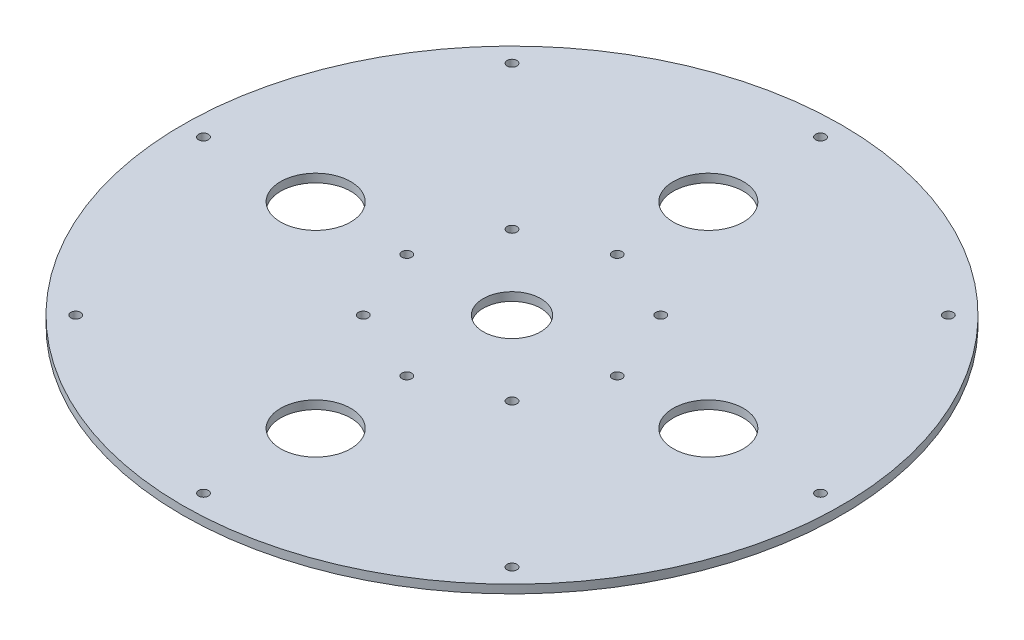
from build123d import *

# Parameters (mm, degrees)
SKETCH1_R           = 117.5
SKETCH1_R_2         = 10.25
SKETCH1_R_3         = 12.5
SKETCH1_R_4         = 1.75
BOSS_EXTRUDE1_DEPTH = 1.5


with BuildPart() as part:
    # Sketch1 → Boss-Extrude1 (new, symmetric)
    with BuildSketch(Plane(origin=(0, 0, 0), x_dir=(1, 0, 0), z_dir=(0, 1, 0))):
        with Locations(Location((0, 0, 0), (0, 0, 270))):
            Circle(SKETCH1_R)
        with Locations(Location((0, 0, 0), (0, 0, 270))):
            Circle(SKETCH1_R_2, mode=Mode.SUBTRACT)
        with Locations(Location((0, 70, 0), (0, 0, 270))):
            Circle(SKETCH1_R_3, mode=Mode.SUBTRACT)
        with Locations(Location((70, 0, 0), (0, 0, 270))):
            Circle(SKETCH1_R_3, mode=Mode.SUBTRACT)
        with Locations(Location((0, -70, 0), (0, 0, 270))):
            Circle(SKETCH1_R_3, mode=Mode.SUBTRACT)
        with Locations(Location((-70, 0, 0), (0, 0, 270))):
            Circle(SKETCH1_R_3, mode=Mode.SUBTRACT)
        with Locations(Location((0, 110, 0), (0, 0, 270))):
            Circle(SKETCH1_R_4, mode=Mode.SUBTRACT)
        with Locations(Location((77.781745931, 77.781745931, 0), (0, 0, 270))):
            Circle(SKETCH1_R_4, mode=Mode.SUBTRACT)
        with Locations(Location((110, 0, 0), (0, 0, 270))):
            Circle(SKETCH1_R_4, mode=Mode.SUBTRACT)
        with Locations(Location((77.781745931, -77.781745931, 0), (0, 0, 270))):
            Circle(SKETCH1_R_4, mode=Mode.SUBTRACT)
        with Locations(Location((0, -110, 0), (0, 0, 270))):
            Circle(SKETCH1_R_4, mode=Mode.SUBTRACT)
        with Locations(Location((-77.781745931, -77.781745931, 0), (0, 0, 270))):
            Circle(SKETCH1_R_4, mode=Mode.SUBTRACT)
        with Locations(Location((-110, 0, 0), (0, 0, 270))):
            Circle(SKETCH1_R_4, mode=Mode.SUBTRACT)
        with Locations(Location((-77.781745931, 77.781745931, 0), (0, 0, 270))):
            Circle(SKETCH1_R_4, mode=Mode.SUBTRACT)
        with Locations(Location((0, 37.5, 0), (0, 0, 270))):
            Circle(SKETCH1_R_4, mode=Mode.SUBTRACT)
        with Locations(Location((26.516504294, 26.516504294, 0), (0, 0, 270))):
            Circle(SKETCH1_R_4, mode=Mode.SUBTRACT)
        with Locations(Location((37.5, 0, 0), (0, 0, 270))):
            Circle(SKETCH1_R_4, mode=Mode.SUBTRACT)
        with Locations(Location((26.516504294, -26.516504294, 0), (0, 0, 270))):
            Circle(SKETCH1_R_4, mode=Mode.SUBTRACT)
        with Locations(Location((0, -37.5, 0), (0, 0, 270))):
            Circle(SKETCH1_R_4, mode=Mode.SUBTRACT)
        with Locations(Location((-26.516504294, -26.516504294, 0), (0, 0, 270))):
            Circle(SKETCH1_R_4, mode=Mode.SUBTRACT)
        with Locations(Location((-37.5, 0, 0), (0, 0, 270))):
            Circle(SKETCH1_R_4, mode=Mode.SUBTRACT)
        with Locations(Location((-26.516504294, 26.516504294, 0), (0, 0, 270))):
            Circle(SKETCH1_R_4, mode=Mode.SUBTRACT)
    extrude(amount=BOSS_EXTRUDE1_DEPTH, both=True)


solid = part.part
